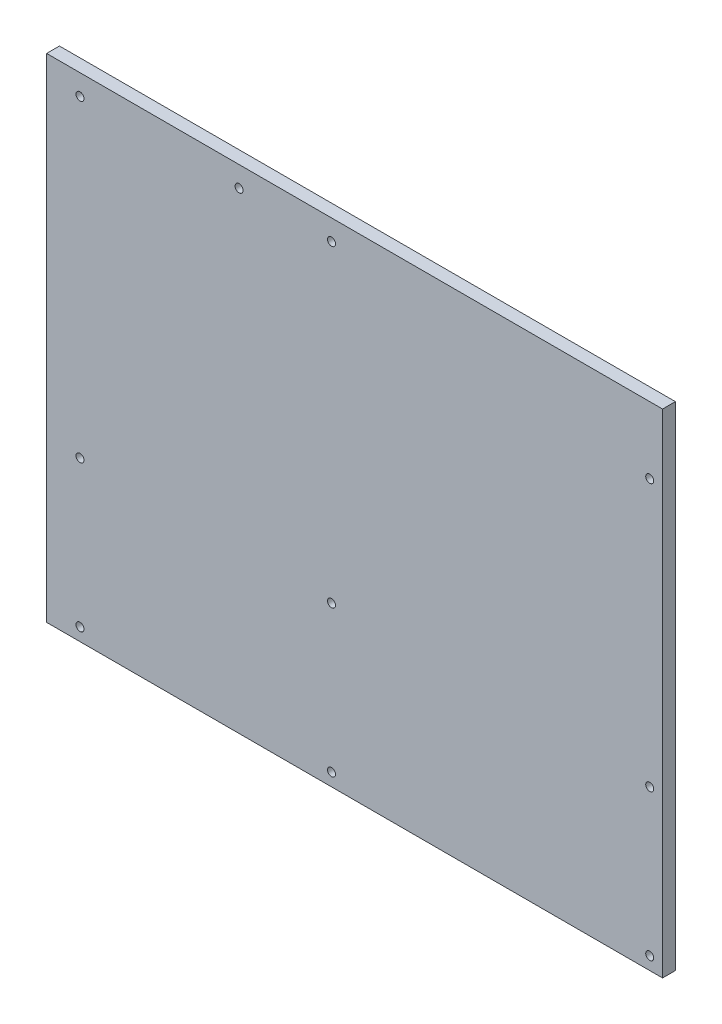
from build123d import *

# Parameters (mm, degrees)
SKETCH2_W           = 304.8
SKETCH2_H           = 243.84
BOSS_EXTRUDE1_DEPTH = 6.35
SKETCH3_R           = 1.97993
CUT_EXTRUDE1_DEPTH  = 196.270501869


with BuildPart() as part:
    # Sketch2 → Boss-Extrude1 (new body)
    with BuildSketch(Plane.XY):
        Rectangle(SKETCH2_W, SKETCH2_H)
    extrude(amount=BOSS_EXTRUDE1_DEPTH)

    # Sketch3 → Cut-Extrude1 (cut, through all)
    with BuildSketch(Plane.XY.offset(6.35)):
        with Locations((-135.89, -43.18)):
            Circle(SKETCH3_R)
        with Locations((-11.43, -43.18)):
            Circle(SKETCH3_R)
        with Locations((146.05, -43.18)):
            Circle(SKETCH3_R)
        with Locations((-135.89, -115.57)):
            Circle(SKETCH3_R)
        with Locations((-11.43, -115.57)):
            Circle(SKETCH3_R)
        with Locations((146.05, -115.57)):
            Circle(SKETCH3_R)
        with Locations((-135.89, 111.76)):
            Circle(SKETCH3_R)
        with Locations((-57.15, 111.76)):
            Circle(SKETCH3_R)
        with Locations((-11.43, 111.76)):
            Circle(SKETCH3_R)
        with Locations((146.05, 88.9)):
            Circle(SKETCH3_R)
    extrude(amount=-CUT_EXTRUDE1_DEPTH, mode=Mode.SUBTRACT)


solid = part.part
